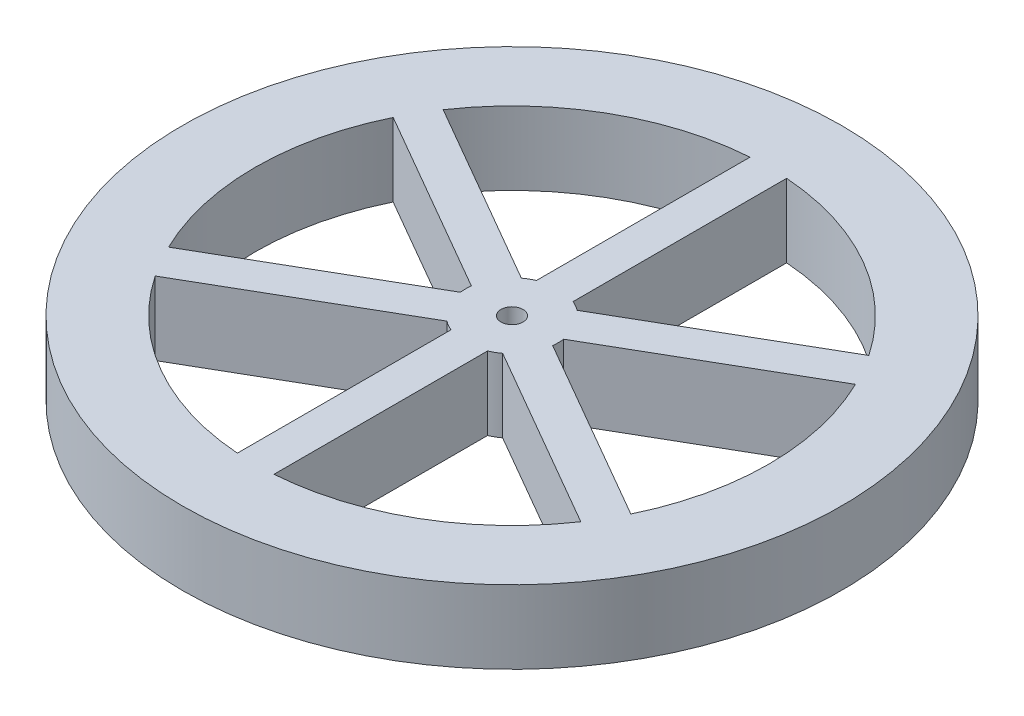
from build123d import *

# Parameters (mm, degrees)
SKETCH1_R           = 45
SKETCH1_R_2         = 1.5
BOSS_EXTRUDE1_DEPTH = 10


with BuildPart() as part:
    # Sketch1 → Boss-Extrude1 (new body)
    with BuildSketch(Plane(origin=(0, 0, 0), x_dir=(1, 0, 0), z_dir=(0, 1, 0))):
        with Locations(Location((0, 0, 0), (0, 0, 270))):
            Circle(SKETCH1_R)
        with Locations(Location((0, 0, 0), (0, 0, 270))):
            Circle(SKETCH1_R_2, mode=Mode.SUBTRACT)
        with BuildLine():
            Line((-2.5, 5.837165408), (-2.5, 35))
            ThreePointArc((-2.5, 35), (-17.54458606, 30.388114453), (-29.060889132, 19.665063509))
            Line((-29.060889132, 19.665063509), (-3.805133529, 5.083646213))
            ThreePointArc((-3.805133529, 5.083646213), (-3.175, 5.499261314), (-2.5, 5.837165408))
        make_face(mode=Mode.SUBTRACT)
        with BuildLine():
            Line((2.5, 5.837165408), (2.5, 35))
            ThreePointArc((2.5, 35), (17.54458606, 30.388114453), (29.060889132, 19.665063509))
            Line((29.060889132, 19.665063509), (3.805133529, 5.083646213))
            ThreePointArc((3.805133529, 5.083646213), (3.175, 5.499261314), (2.5, 5.837165408))
        make_face(mode=Mode.SUBTRACT)
        with BuildLine():
            Line((6.305133529, 0.753519195), (31.560889132, 15.334936491))
            ThreePointArc((31.560889132, 15.334936491), (35.089172119, 0), (31.560889132, -15.334936491))
            Line((31.560889132, -15.334936491), (6.305133529, -0.753519195))
            ThreePointArc((6.305133529, -0.753519195), (6.35, 0), (6.305133529, 0.753519195))
        make_face(mode=Mode.SUBTRACT)
        with BuildLine():
            Line((3.805133529, -5.083646213), (29.060889132, -19.665063509))
            ThreePointArc((29.060889132, -19.665063509), (17.54458606, -30.388114453), (2.5, -35))
            Line((2.5, -35), (2.5, -5.837165408))
            ThreePointArc((2.5, -5.837165408), (3.175, -5.499261314), (3.805133529, -5.083646213))
        make_face(mode=Mode.SUBTRACT)
        with BuildLine():
            Line((-2.5, -5.837165408), (-2.5, -35))
            ThreePointArc((-2.5, -35), (-17.54458606, -30.388114453), (-29.060889132, -19.665063509))
            Line((-29.060889132, -19.665063509), (-3.805133529, -5.083646213))
            ThreePointArc((-3.805133529, -5.083646213), (-3.175, -5.499261314), (-2.5, -5.837165408))
        make_face(mode=Mode.SUBTRACT)
        with BuildLine():
            Line((-6.305133529, -0.753519195), (-31.560889132, -15.334936491))
            ThreePointArc((-31.560889132, -15.334936491), (-35.089172119, 0), (-31.560889132, 15.334936491))
            Line((-31.560889132, 15.334936491), (-6.305133529, 0.753519195))
            ThreePointArc((-6.305133529, 0.753519195), (-6.35, 0), (-6.305133529, -0.753519195))
        make_face(mode=Mode.SUBTRACT)
    extrude(amount=BOSS_EXTRUDE1_DEPTH)


solid = part.part
